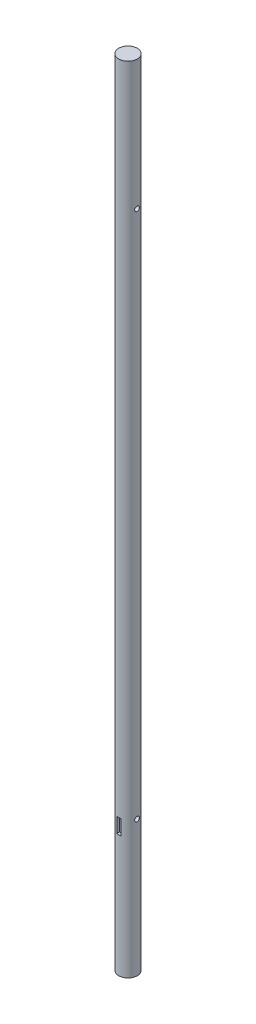
from build123d import *

# Parameters (mm, degrees)
CROQUIS1_R                 = 18.75
SALIENTE_EXTRUIR1_DEPTH    = 1600
CROQUIS3_W                 = 8.15
CROQUIS3_H                 = 30
CORTAR_EXTRUIR1_DEPTH      = 5.75
CORTAR_EXTRUIR2_DEPTH      = 1601.219711477
CORTAR_EXTRUIR2_DEPTH_BACK = 1601.219711477
CROQUIS5_R                 = 4.7625
CORTAR_EXTRUIR3_DEPTH      = 1601.219711579
CORTAR_EXTRUIR3_DEPTH_BACK = 1601.219711579
CROQUIS6_R                 = 4.7625


with BuildPart() as part:
    # Croquis1 → Saliente-Extruir1 (new body)
    with BuildSketch(Plane(origin=(0, 0, 0), x_dir=(1, 0, 0), z_dir=(0, 1, 0))):
        with Locations(Location((0, 0, 0), (0, 0, 270))):
            Circle(CROQUIS1_R)
    extrude(amount=SALIENTE_EXTRUIR1_DEPTH)

    # Croquis3 → Cortar-Extruir1 (cut)
    with BuildSketch(Plane.XY.offset(18.75)):
        with Locations((0, 261.062165694)):
            Rectangle(CROQUIS3_W, CROQUIS3_H)
    cortar_extruir1 = extrude(amount=-CORTAR_EXTRUIR1_DEPTH, mode=Mode.SUBTRACT)

    # Simetría1: Cortar-Extruir1 across plane
    add(cortar_extruir1.mirror(Plane.XY), mode=Mode.SUBTRACT)

    # Croquis5 → Cortar-Extruir2 (cut, two sides: drawn at the far end of the back side and taken through both)
    with BuildSketch(Plane(origin=(0, 0, 0), x_dir=(0, 0, -1), z_dir=(1, 0, 0)).offset(-CORTAR_EXTRUIR2_DEPTH_BACK)):
        with Locations((0, 273.56)):
            Circle(CROQUIS5_R)
    extrude(amount=CORTAR_EXTRUIR2_DEPTH + CORTAR_EXTRUIR2_DEPTH_BACK, mode=Mode.SUBTRACT)

    # Croquis6 → Cortar-Extruir3 (cut, two sides: drawn at the far end of the back side and taken through both)
    with BuildSketch(Plane(origin=(0, 0, 0), x_dir=(0, 0, -1), z_dir=(1, 0, 0)).offset(-CORTAR_EXTRUIR3_DEPTH_BACK)):
        with Locations((0, 1338.56)):
            Circle(CROQUIS6_R)
    extrude(amount=CORTAR_EXTRUIR3_DEPTH + CORTAR_EXTRUIR3_DEPTH_BACK, mode=Mode.SUBTRACT)


solid = part.part
